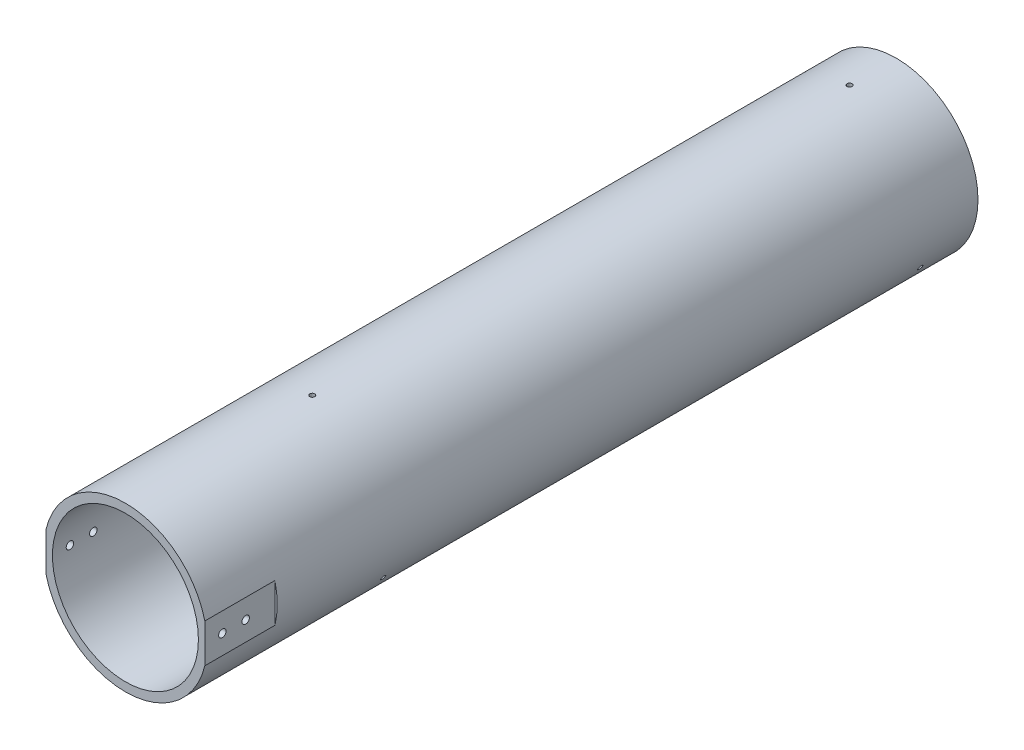
from build123d import *

# Parameters (mm, degrees)
SKETCH1_R                       = 44.45
SKETCH1_R_2                     = 39.6875
BOSS_EXTRUDE1_DEPTH             = 209.55
SKETCH2_W                       = 7.89975339
SKETCH2_H                       = 28.462346772
CUT_EXTRUDE1_DEPTH              = 38.1
F_10_32_TAPPED_HOLE1_AT_2_COUNT = 2
F_10_32_TAPPED_HOLE1_AT_2_PITCH = 12.7
F_6_32_TAPPED_HOLE1_D           = 2.7051
F_6_32_TAPPED_HOLE1_DEPTH       = 14.986
F_6_32_TAPPED_HOLE1_TIP         = 0.81269403
F_6_32_TAPPED_HOLE2_REACH       = 408.053
F_6_32_TAPPED_HOLE2_BORE_R      = 1.35255
CIRPATTERN1_COUNT               = 3


with BuildPart() as part:
    # Sketch1 → Boss-Extrude1 (new, symmetric)
    with BuildSketch(Plane.XY):
        Circle(SKETCH1_R)
        Circle(SKETCH1_R_2, mode=Mode.SUBTRACT)
    extrude(amount=BOSS_EXTRUDE1_DEPTH, both=True)

    # Sketch2 → Cut-Extrude1 (cut)
    with BuildSketch(Plane.XY.offset(209.55)):
        with Locations((47.129876695, -0.406604954)):
            Rectangle(SKETCH2_W, SKETCH2_H)
    cut_extrude1 = extrude(amount=-CUT_EXTRUDE1_DEPTH, mode=Mode.SUBTRACT)

    # Sketch3 → #10-32 Tapped Hole1 (revolve, cut)
    with BuildSketch(Plane(origin=(43.18, 0, 200.025), x_dir=(0, 0, -1), z_dir=(0, 1, 0))):
        Polygon((0, 0), (0, 14.929317848), (2.0193, 13.716), (2.0193, 0), align=None)
    f_10_32_tapped_hole1 = revolve(axis=Axis((49.53, 0, 200.025), (-1, 0, 0)), mode=Mode.SUBTRACT)

    # #10-32 Tapped Hole1 at 2: #10-32 Tapped Hole1 ×2
    with Locations(*[(0, 0, -i * F_10_32_TAPPED_HOLE1_AT_2_PITCH) for i in range(1, F_10_32_TAPPED_HOLE1_AT_2_COUNT)]):
        add(f_10_32_tapped_hole1, mode=Mode.SUBTRACT)

    # #6-32 Tapped Hole1
    with Locations(Plane(origin=(0, 0, -209.55), x_dir=(-1, 0, 0), z_dir=(0, 0, -1))):
        with Locations((0, 42.06875), (-42.06875, 0), (42.06875, 0), (0, -42.06875)):
            Hole(F_6_32_TAPPED_HOLE1_D / 2, depth=F_6_32_TAPPED_HOLE1_DEPTH)
            with Locations((0, 0, -(F_6_32_TAPPED_HOLE1_DEPTH + F_6_32_TAPPED_HOLE1_TIP / 2))):  # 118° drill point
                Cone(0, F_6_32_TAPPED_HOLE1_D / 2, F_6_32_TAPPED_HOLE1_TIP, mode=Mode.SUBTRACT)

    # Mirror1: Cut-Extrude1, #10-32 Tapped Hole1 across plane
    add(cut_extrude1.mirror(Plane(origin=(0, 0, 0), x_dir=(0, 0, 1), z_dir=(1, 0, 0))), mode=Mode.SUBTRACT)
    add(f_10_32_tapped_hole1.mirror(Plane(origin=(0, 0, 0), x_dir=(0, 0, 1), z_dir=(1, 0, 0))), mode=Mode.SUBTRACT)

    # Mirror1 copy 1 sketch → Mirror1 copy 1 (revolve, cut)
    with BuildSketch(Plane(origin=(-43.18, 0, 187.325), x_dir=(0, 0, -1), z_dir=(0, 1, 0))):
        Polygon((0, 0), (0, -14.929317848), (2.0193, -13.716), (2.0193, 0), align=None)
    revolve(axis=Axis((-49.53, 0, 187.325), (-1, 0, 0)), mode=Mode.SUBTRACT)

    # #6-32 Tapped Hole2 bore (on position points) → #6-32 Tapped Hole2 (cut, up to next)
    with BuildSketch(Plane(origin=(0, 44.45, -184.15), x_dir=(1, 0, 0), z_dir=(0, 1, 0)), mode=Mode.PRIVATE) as f_6_32_tapped_hole2_sk1:
        Circle(F_6_32_TAPPED_HOLE2_BORE_R)
    f_6_32_tapped_hole2_tool1 = extrude(f_6_32_tapped_hole2_sk1.sketch, amount=-F_6_32_TAPPED_HOLE2_REACH, mode=Mode.PRIVATE) & part.part
    # #6-32 Tapped Hole2 bore (on position points) → #6-32 Tapped Hole2 (cut, up to next)
    with BuildSketch(Plane(origin=(0, 44.45, -184.15), x_dir=(1, 0, 0), z_dir=(0, 1, 0)), mode=Mode.PRIVATE) as f_6_32_tapped_hole2_sk2:
        with Locations((0, -292.1)):
            Circle(F_6_32_TAPPED_HOLE2_BORE_R)
    f_6_32_tapped_hole2_tool2 = extrude(f_6_32_tapped_hole2_sk2.sketch, amount=-F_6_32_TAPPED_HOLE2_REACH, mode=Mode.PRIVATE) & part.part
    f_6_32_tapped_hole2_1 = f_6_32_tapped_hole2_tool1.solids().sort_by_distance((0, 44.45, -184.15))[0]
    add(f_6_32_tapped_hole2_1, mode=Mode.SUBTRACT)
    f_6_32_tapped_hole2_2 = f_6_32_tapped_hole2_tool2.solids().sort_by_distance((0, 44.45, 107.95))[0]
    add(f_6_32_tapped_hole2_2, mode=Mode.SUBTRACT)
    f_6_32_tapped_hole2 = f_6_32_tapped_hole2_1 + f_6_32_tapped_hole2_2  # #6-32 Tapped Hole2 as one shape, for the pattern or mirror that repeats it

    # CirPattern1: #6-32 Tapped Hole2 ×3 about axis
    cirpattern1_axis = Axis((0, 0, -209.55), (0, 0, 1))
    for i in range(1, CIRPATTERN1_COUNT):
        add(f_6_32_tapped_hole2.rotate(cirpattern1_axis, i * 360 / CIRPATTERN1_COUNT), mode=Mode.SUBTRACT)


solid = part.part
